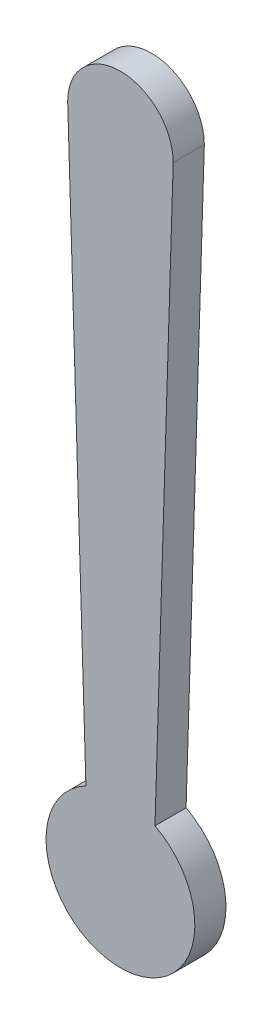
from build123d import *

# Parameters (mm, degrees)
EXTRUDE_1_DEPTH = 11.5


with BuildPart() as part:
    # 草图1 → 凸台-拉伸1 (new body)
    with BuildSketch(Plane.XY):
        with BuildLine():
            Line((12.761244256, -95.640183805), (19.5, 120))
            ThreePointArc((19.5, 120), (0, 139.5), (-19.5, 120))
            Line((-19.5, 120), (-12.761244256, -95.640183805))
            ThreePointArc((-12.761244256, -95.640183805), (0, -147.5), (12.761244256, -95.640183805))
        make_face()
    extrude(amount=EXTRUDE_1_DEPTH)


solid = part.part
